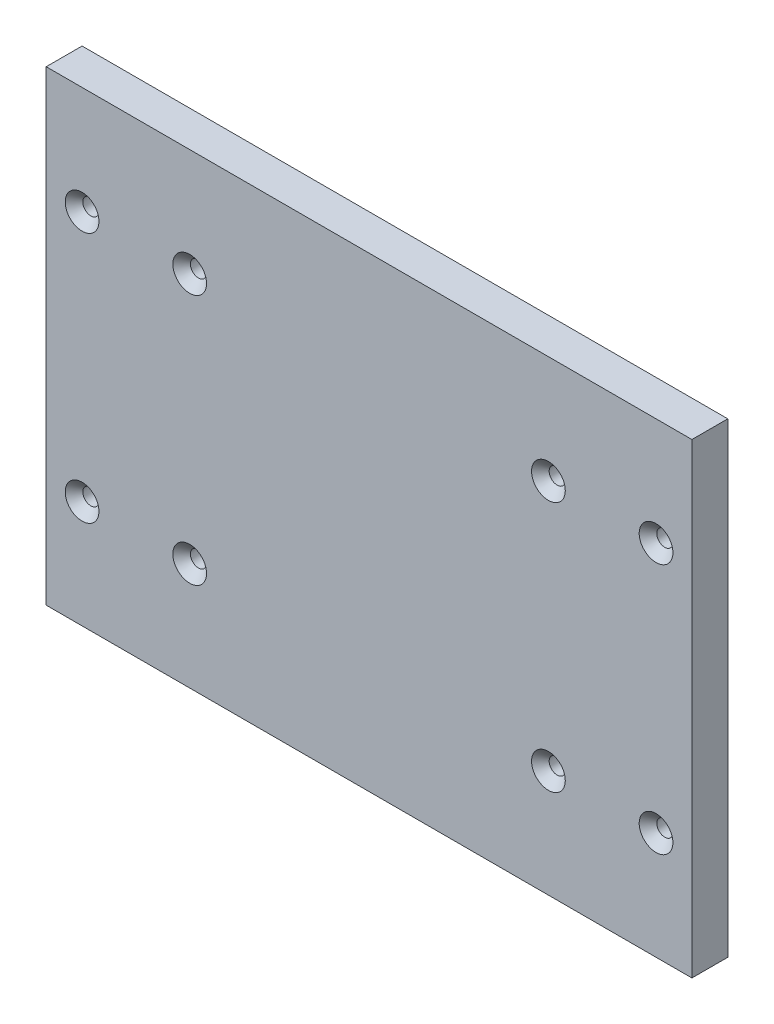
from build123d import *

# Parameters (mm, degrees)
SKETCH1_W                                           = 180
SKETCH1_H                                           = 130
BOSS_EXTRUDE1_DEPTH                                 = 10
CSK_FOR_M4_COUNTERSUNK_FLAT_HEAD_SCREW1_D           = 4.5
CSK_FOR_M4_COUNTERSUNK_FLAT_HEAD_SCREW1_DEPTH       = 6
CSK_FOR_M4_COUNTERSUNK_FLAT_HEAD_SCREW1_CSINK_D     = 9.4
CSK_FOR_M4_COUNTERSUNK_FLAT_HEAD_SCREW1_CSINK_ANGLE = 90
CSK_FOR_M4_COUNTERSUNK_FLAT_HEAD_SCREW1_TIP         = 1.351936393


with BuildPart() as part:
    # Sketch1 → Boss-Extrude1 (new body)
    with BuildSketch(Plane.XY):
        with Locations((90, 65)):
            Rectangle(SKETCH1_W, SKETCH1_H)
    extrude(amount=BOSS_EXTRUDE1_DEPTH)

    # CSK for M4 Countersunk Flat Head Screw1
    with Locations(Plane.XY.offset(10)):
        with Locations((10, 100), (40, 100), (10, 30), (40, 30), (140, 100), (170, 100), (140, 30), (170, 30)):
            CounterSinkHole(CSK_FOR_M4_COUNTERSUNK_FLAT_HEAD_SCREW1_D / 2, CSK_FOR_M4_COUNTERSUNK_FLAT_HEAD_SCREW1_CSINK_D / 2, depth=CSK_FOR_M4_COUNTERSUNK_FLAT_HEAD_SCREW1_DEPTH, counter_sink_angle=CSK_FOR_M4_COUNTERSUNK_FLAT_HEAD_SCREW1_CSINK_ANGLE)
            with Locations((0, 0, -(CSK_FOR_M4_COUNTERSUNK_FLAT_HEAD_SCREW1_DEPTH + CSK_FOR_M4_COUNTERSUNK_FLAT_HEAD_SCREW1_TIP / 2))):  # 118° drill point
                Cone(0, CSK_FOR_M4_COUNTERSUNK_FLAT_HEAD_SCREW1_D / 2, CSK_FOR_M4_COUNTERSUNK_FLAT_HEAD_SCREW1_TIP, mode=Mode.SUBTRACT)


solid = part.part
